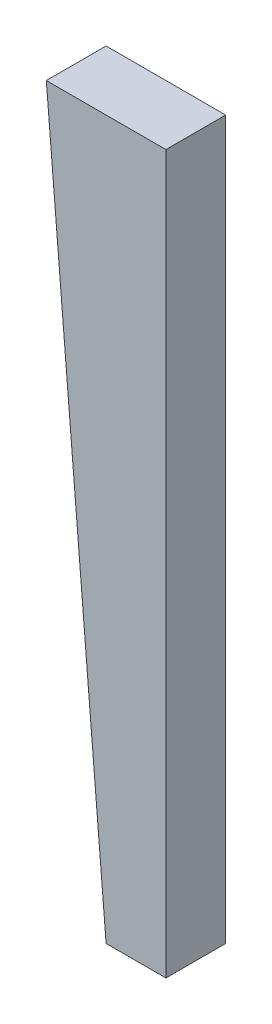
from build123d import *

# Parameters (mm, degrees)
BOSS_EXTRU_1_DEPTH = 1


with BuildPart() as part:
    # Esquisse1 → Boss.-Extru.1 (new body)
    with BuildSketch(Plane.XY):
        Polygon((-1, 6), (0, -6), (1, -6), (1, 6), align=None)
    extrude(amount=BOSS_EXTRU_1_DEPTH)


solid = part.part
